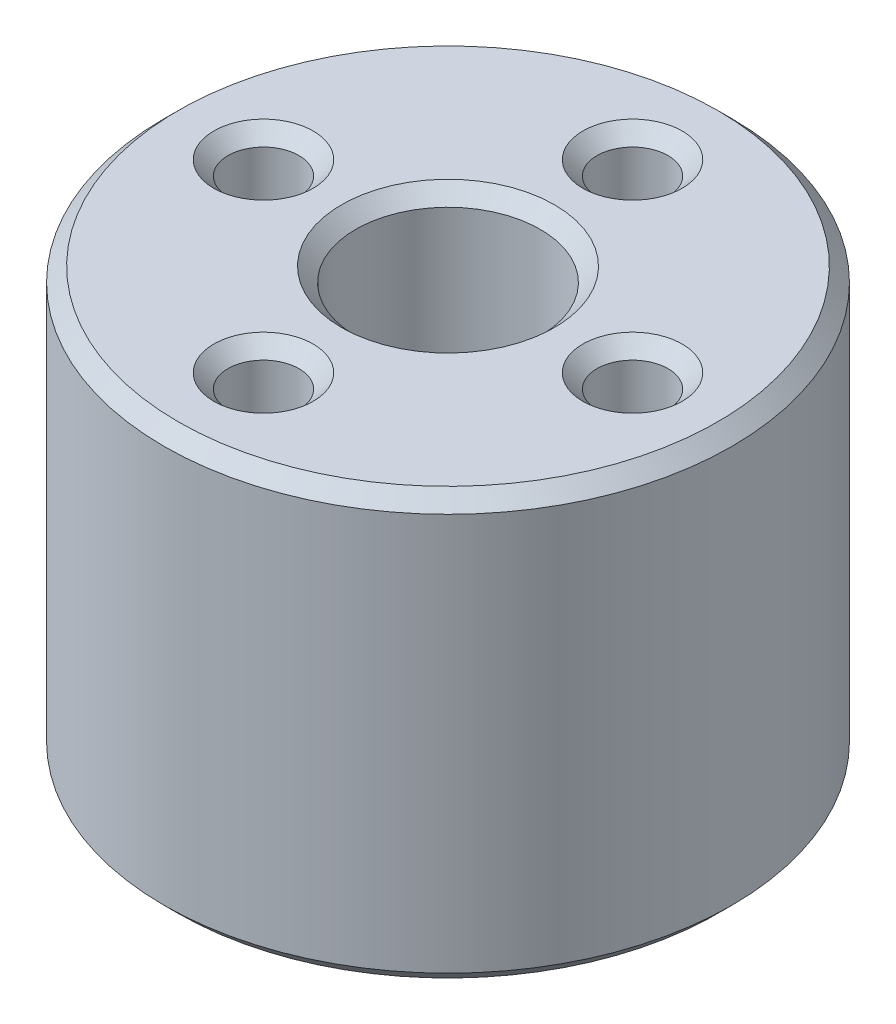
from build123d import *

# Parameters (mm, degrees)
SKETCH_1_R               = 10
SKETCH_1_R_2             = 3.25
EXTRUDE_1_DEPTH          = 15
SKETCH_2_R               = 1.25
CUT_EXTRUDE_1_DEPTH      = 15
PATTERN_CIRCULAR_1_COUNT = 4
CHAMFER_1_SIZE           = 0.5


with BuildPart() as part:
    # 草图1 → 凸台-拉伸1 (new body)
    with BuildSketch(Plane(origin=(0, 0, 0), x_dir=(1, 0, 0), z_dir=(0, 1, 0))):
        with Locations(Location((0, 0, 0), (0, 0, 270))):
            Circle(SKETCH_1_R)
        with Locations(Location((0, 0, 0), (0, 0, 270))):
            Circle(SKETCH_1_R_2, mode=Mode.SUBTRACT)
    extrude(amount=EXTRUDE_1_DEPTH)

    # 草图2 → 切除-拉伸1 (cut)
    with BuildSketch(Plane(origin=(0, 15, 0), x_dir=(1, 0, 0), z_dir=(0, 1, 0))):
        with Locations(Location((-6.5, 0, 0), (0, 0, 270))):
            Circle(SKETCH_2_R)
    cut_extrude_1 = extrude(amount=-CUT_EXTRUDE_1_DEPTH, mode=Mode.SUBTRACT)

    # 阵列(圆周)1: 切除-拉伸1 ×4 about axis
    pattern_circular_1_axis = Axis((0, 0, 0), (0, 1, 0))
    for i in range(1, PATTERN_CIRCULAR_1_COUNT):
        add(cut_extrude_1.rotate(pattern_circular_1_axis, i * 360 / PATTERN_CIRCULAR_1_COUNT), mode=Mode.SUBTRACT)

    # 倒角1
    chamfer_1_edges = [part.edges().sort_by_distance(p)[0] for p in [
        (-6.5, 0, -1.25),
        (-6.5, 15, -1.25),
        (1.25, 0, -6.5),
        (1.25, 15, -6.5),
        (0, 0, -10),
        (6.5, 0, 1.25),
        (6.5, 15, 1.25),
        (-1.25, 0, 6.5),
        (-1.25, 15, 6.5),
        (0, 15, -10),
        (0, 0, -3.25),
        (0, 15, -3.25),
    ]]
    chamfer(chamfer_1_edges, length=CHAMFER_1_SIZE)


solid = part.part
